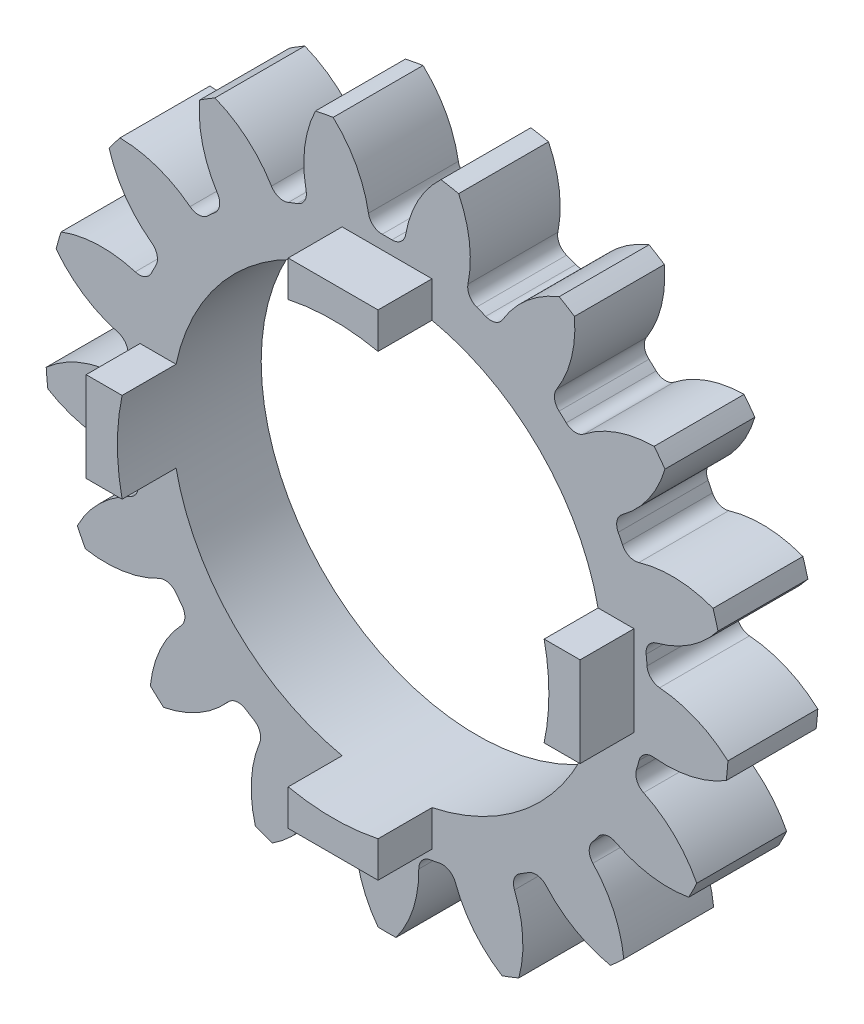
from build123d import *

# Parameters (mm, degrees)
SKETCH1_R                = 19
BOSS_EXTRUDE1_DEPTH      = 5
CUT_EXTRUDE1_DEPTH       = 10
FILLET2_R                = 0.76
CIRPATTERN2_COUNT        = 17
FILLET2_OF_CIRPATTERN2_R = 0.76
SKETCH2_R                = 12
CUT_EXTRUDE2_DEPTH       = 5
BOSS_EXTRUDE2_START      = 3
BOSS_EXTRUDE2_DEPTH      = 3


with BuildPart() as part:
    # Sketch1 → Boss-Extrude1 (new body)
    with BuildSketch(Plane.XY):
        Circle(SKETCH1_R)
    extrude(amount=-BOSS_EXTRUDE1_DEPTH)

    # Sketch1<4> → Cut-Extrude1 (cut)
    with BuildSketch(Plane.XY):
        with BuildLine():
            ThreePointArc((-0.955559523, 14.46847974), (0, 14.5), (0.955559523, 14.46847974))
            ThreePointArc((0.955559523, 14.46847974), (1.566228552, 16.810685871), (2.998587958, 18.761888771))
            ThreePointArc((2.998587958, 18.761888771), (0, 19), (-2.998587958, 18.761888771))
            ThreePointArc((-2.998587958, 18.761888771), (-1.566228552, 16.810685871), (-0.955559523, 14.46847974))
        make_face()
    cut_extrude1 = extrude(amount=-CUT_EXTRUDE1_DEPTH, mode=Mode.SUBTRACT)

    # Fillet2
    fillet2_edges = [part.edges().sort_by_distance(p)[0] for p in [
        (0.955559523, 14.46847974, -2.5),
        (-0.955559523, 14.46847974, -2.5),
    ]]
    fillet(fillet2_edges, radius=FILLET2_R)

    # CirPattern2: Cut-Extrude1 ×17 about axis
    cirpattern2_axis = Axis((0, 0, 0), (0, 0, 1))
    for i in range(1, CIRPATTERN2_COUNT):
        add(cut_extrude1.rotate(cirpattern2_axis, i * 360 / CIRPATTERN2_COUNT), mode=Mode.SUBTRACT)

    # Fillet2 of CirPattern2
    fillet2_of_cirpattern2_edges = [part.edges().sort_by_distance(p)[0] for p in [
        (-4.33558501, 13.836643474, -2.5),
        (-6.117650448, 13.146267645, -2.5),
        (-9.041184763, 11.336091835, -2.5),
        (-10.45351878, 10.048579259, -2.5),
        (-12.525722415, 7.304538178, -2.5),
        (-13.377581476, 5.593774562, -2.5),
        (-14.318591847, 2.286466164, -2.5),
        (-14.494927666, 0.383499615, -2.5),
        (-14.177656108, -3.040405774, -2.5),
        (-13.654653556, -4.878569081, -2.5),
        (-12.121949351, -7.956654066, -2.5),
        (-10.970242819, -9.481759989, -2.5),
        (-8.429106164, -11.798312137, -2.5),
        (-6.804240002, -12.80438667, -2.5),
        (-3.597865482, -14.046542776, -2.5),
        (-1.719286869, -14.39770998, -2.5),
        (1.719286869, -14.39770998, -2.5),
        (3.597865482, -14.046542776, -2.5),
        (6.804240002, -12.80438667, -2.5),
        (8.429106164, -11.798312137, -2.5),
        (10.970242819, -9.481759989, -2.5),
        (12.121949351, -7.956654066, -2.5),
        (13.654653556, -4.878569081, -2.5),
        (14.177656108, -3.040405774, -2.5),
        (14.494927666, 0.383499615, -2.5),
        (14.318591847, 2.286466164, -2.5),
        (13.377581476, 5.593774562, -2.5),
        (12.525722415, 7.304538178, -2.5),
        (10.45351878, 10.048579259, -2.5),
        (9.041184763, 11.336091835, -2.5),
        (6.117650448, 13.146267645, -2.5),
        (4.33558501, 13.836643474, -2.5),
    ]]
    fillet(fillet2_of_cirpattern2_edges, radius=FILLET2_OF_CIRPATTERN2_R)

    # Sketch2 → Cut-Extrude2 (cut)
    with BuildSketch(Plane.XY):
        Circle(SKETCH2_R)
    extrude(amount=-CUT_EXTRUDE2_DEPTH, mode=Mode.SUBTRACT)

    # Sketch3 → Boss-Extrude2 (add)
    with BuildSketch(Plane.XY.offset(BOSS_EXTRUDE2_START)):
        with BuildLine():
            Line((-2.5, 11.736694594), (-2.5, 13.736694594))
            Line((-2.5, 13.736694594), (2.5, 13.736694594))
            Line((2.5, 13.736694594), (2.5, 11.736694594))
            ThreePointArc((2.5, 11.736694594), (0, 12), (-2.5, 11.736694594))
        make_face()
        with BuildLine():
            Line((13.736694594, -2.5), (11.736694594, -2.5))
            ThreePointArc((11.736694594, -2.5), (12, 0), (11.736694594, 2.5))
            Line((11.736694594, 2.5), (13.736694594, 2.5))
            Line((13.736694594, 2.5), (13.736694594, -2.5))
        make_face()
        with BuildLine():
            Line((-2.5, -13.736694594), (-2.5, -11.736694594))
            ThreePointArc((-2.5, -11.736694594), (0, -12), (2.5, -11.736694594))
            Line((2.5, -11.736694594), (2.5, -13.736694594))
            Line((2.5, -13.736694594), (-2.5, -13.736694594))
        make_face()
        with BuildLine():
            Line((-13.736694594, 2.5), (-11.736694594, 2.5))
            ThreePointArc((-11.736694594, 2.5), (-12, 0), (-11.736694594, -2.5))
            Line((-11.736694594, -2.5), (-13.736694594, -2.5))
            Line((-13.736694594, -2.5), (-13.736694594, 2.5))
        make_face()
    extrude(amount=-BOSS_EXTRUDE2_DEPTH)


solid = part.part
